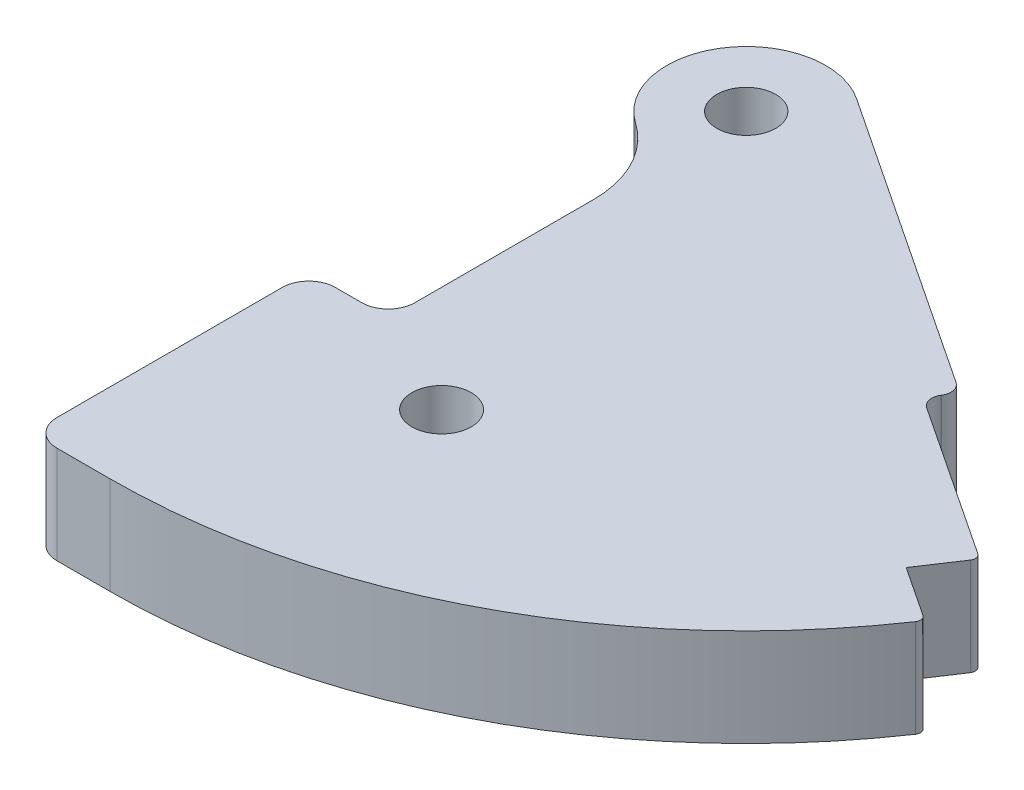
from build123d import *

# Parameters (mm, degrees)
SKETCH1_R           = 1.778
SKETCH1_R_2         = 1.7653
BOSS_EXTRUDE1_DEPTH = 5.842
FILLET3_R           = 1.5875
FILLET6_R           = 6.35
FILLET7_R           = 0.396875
FILLET9_R           = 0.79375


with BuildPart() as part:
    # Sketch1 → Boss-Extrude1 (new body)
    # profile 1 of 2: a face of its own
    with BuildSketch(Plane(origin=(0, 0, 0), x_dir=(1, 0, 0), z_dir=(0, 1, 0))):
        with BuildLine():
            ThreePointArc((4.7625, 0), (3.367596045, -3.367596045), (0, -4.7625))
            Line((0, -4.7625), (0, -21.43125))
            Line((0, -21.43125), (-4.7625, -21.43125))
            Line((-4.7625, -21.43125), (-4.7625, -38.1))
            Line((-4.7625, -38.1), (0, -38.1))
            ThreePointArc((0, -38.1), (18.016692001, -33.570951868), (31.75, -21.060567419))
            Line((31.75, -21.060567419), (28.442708333, -18.866758313))
            Line((28.442708333, -18.866758313), (30.197755618, -16.220924979))
            Line((30.197755618, -16.220924979), (20.130923816, -9.543344196))
            Line((20.130923816, -9.543344196), (20.98465671, -8.204646532))
            Line((20.98465671, -8.204646532), (2.632570927, 3.96875))
            ThreePointArc((2.632570927, 3.96875), (4.196368984, 2.2520865), (4.7625, 0))
        make_face()
        with Locations(Location((6.35, -24.593444248, 0), (0, 0, 270))):
            Circle(SKETCH1_R, mode=Mode.SUBTRACT)
    # profile 2 of 2: a face of its own
    with BuildSketch(Plane(origin=(0, 0, 0), x_dir=(1, 0, 0), z_dir=(0, 1, 0))):
        with BuildLine():
            ThreePointArc((4.7625, 0), (3.367596045, -3.367596045), (0, -4.7625))
            ThreePointArc((0, -4.7625), (-3.367596045, 3.367596045), (4.7625, 0))
        make_face()
        with Locations(Location((0, 0, 0), (0, 0, 270))):
            Circle(SKETCH1_R_2, mode=Mode.SUBTRACT)
    extrude(amount=BOSS_EXTRUDE1_DEPTH)

    # Fillet3
    fillet3_edges = [part.edges().sort_by_distance(p)[0] for p in [
        (-4.7625, 2.921, 38.1),
        (-4.7625, 2.921, 21.43125),
        (0, 2.921, 21.43125),
    ]]
    fillet(fillet3_edges, radius=FILLET3_R)

    # Fillet6
    fillet6_edges = [part.edges().sort_by_distance(p)[0] for p in [
        (0, 2.921, 4.7625),
    ]]
    fillet(fillet6_edges, radius=FILLET6_R)

    # Fillet7
    fillet7_edges = [part.edges().sort_by_distance(p)[0] for p in [
        (30.197755618, 2.921, 16.220924979),
        (31.75, 2.921, 21.060567419),
    ]]
    fillet(fillet7_edges, radius=FILLET7_R)

    # Fillet9
    fillet9_edges = [part.edges().sort_by_distance(p)[0] for p in [
        (20.98465671, 2.921, 8.204646532),
        (20.130923816, 2.921, 9.543344196),
    ]]
    fillet(fillet9_edges, radius=FILLET9_R)


solid = part.part
